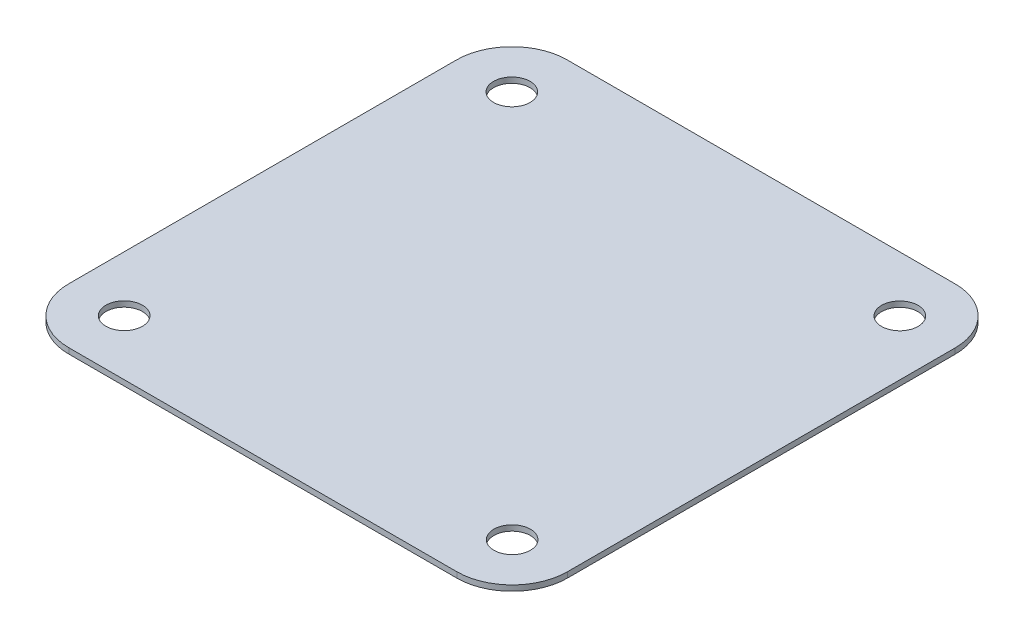
from build123d import *

# Parameters (mm, degrees)
SKETCH1_W                                  = 45.025374044
SKETCH1_H                                  = 45
BOSS_EXTRUDE1_DEPTH                        = 60
FILLET3_R                                  = 5
FILLET4_R                                  = 5
FILLET7_R                                  = 5
FILLET8_R                                  = 5
SKETCH9_R                                  = 1.65
CUT_EXTRUDE6_DEPTH                         = 5
MIRROR2_AT_THE_SECOND_PLANE_COPY_1_SKETC_R = 1.65
MIRROR2_AT_THE_SECOND_PLANE_COPY_1_DEPTH   = 5
SKETCH10_W                                 = 54.362738508
SKETCH10_H                                 = 47.512908914
CUT_EXTRUDE7_DEPTH                         = 59.5


with BuildPart() as part:
    # Sketch1 → Boss-Extrude1 (new body)
    with BuildSketch(Plane(origin=(0, 0, 0), x_dir=(1, 0, 0), z_dir=(0, 1, 0))):
        Rectangle(SKETCH1_W, SKETCH1_H)
    extrude(amount=BOSS_EXTRUDE1_DEPTH)

    # Fillet3
    fillet3_edges = [part.edges().sort_by_distance(p)[0] for p in [
        (22.512687022, 30, -22.5),
    ]]
    fillet(fillet3_edges, radius=FILLET3_R)

    # Fillet4
    fillet4_edges = [part.edges().sort_by_distance(p)[0] for p in [
        (-22.512687022, 30, -22.5),
    ]]
    fillet(fillet4_edges, radius=FILLET4_R)

    # Fillet7
    fillet7_edges = [part.edges().sort_by_distance(p)[0] for p in [
        (22.512687022, 30, 22.5),
    ]]
    fillet(fillet7_edges, radius=FILLET7_R)

    # Fillet8
    fillet8_edges = [part.edges().sort_by_distance(p)[0] for p in [
        (-22.512687022, 30, 22.5),
    ]]
    fillet(fillet8_edges, radius=FILLET8_R)

    # Sketch9 → Cut-Extrude6 (cut)
    with BuildSketch(Plane(origin=(0, 60, 0), x_dir=(1, 0, 0), z_dir=(0, 1, 0))):
        with Locations(Location((-17.512687022, 17.5, 0), (0, 0, 270))):
            Circle(SKETCH9_R)
    cut_extrude6 = extrude(amount=-CUT_EXTRUDE6_DEPTH, mode=Mode.SUBTRACT)

    # Mirror2: Cut-Extrude6 across plane
    add(cut_extrude6.mirror(Plane(origin=(0, 0, 0), x_dir=(0, 0, 1), z_dir=(1, 0, 0))), mode=Mode.SUBTRACT)

    # Mirror2 at the second plane: Cut-Extrude6 across plane
    add(cut_extrude6.mirror(Plane.XY), mode=Mode.SUBTRACT)

    # Mirror2 at the second plane copy 1 sketc → Mirror2 at the second plane copy 1 (cut)
    with BuildSketch(Plane(origin=(0, 60, 0), x_dir=(-1, 0, 0), z_dir=(0, 1, 0))):
        with Locations(Location((-17.512687022, 17.5, 0), (0, 0, 270))):
            Circle(MIRROR2_AT_THE_SECOND_PLANE_COPY_1_SKETC_R)
    extrude(amount=-MIRROR2_AT_THE_SECOND_PLANE_COPY_1_DEPTH, mode=Mode.SUBTRACT)

    # Sketch10 → Cut-Extrude7 (cut)
    with BuildSketch(Plane.XZ):
        Rectangle(SKETCH10_W, SKETCH10_H)
    extrude(amount=-CUT_EXTRUDE7_DEPTH, mode=Mode.SUBTRACT)


solid = part.part
